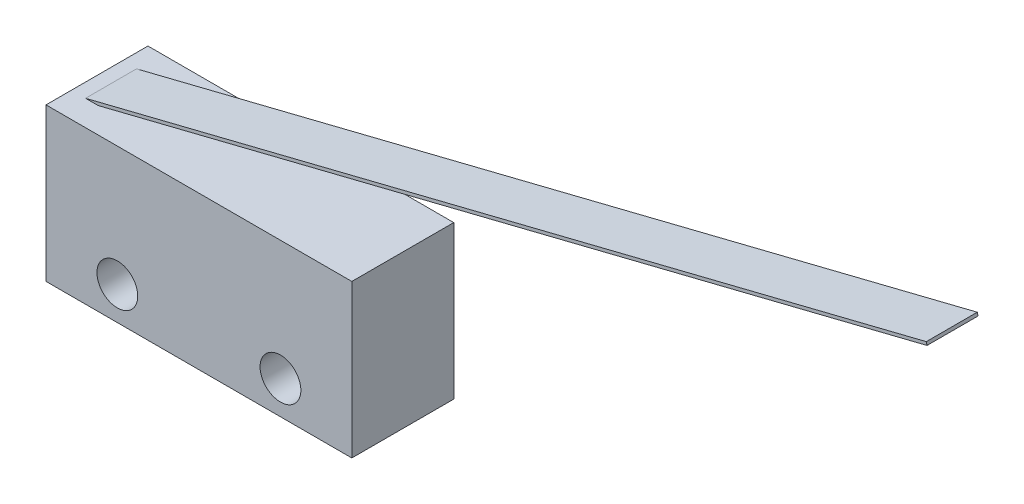
from build123d import *

# Parameters (mm, degrees)
SKETCH1_W           = 19.05
SKETCH1_H           = 9.525
BOSS_EXTRUDE1_DEPTH = 6.35
BOSS_EXTRUDE2_START = 1.5875
BOSS_EXTRUDE2_DEPTH = 3.175
SKETCH3_R           = 1.27
CUT_EXTRUDE1_DEPTH  = 59.227939899


with BuildPart() as part:
    # Sketch1 → Boss-Extrude1 (new body)
    with BuildSketch(Plane.XY):
        with Locations((9.525, 4.7625)):
            Rectangle(SKETCH1_W, SKETCH1_H)
    extrude(amount=BOSS_EXTRUDE1_DEPTH)

    # Sketch2 → Boss-Extrude2 (add)
    with BuildSketch(Plane.XY.offset(BOSS_EXTRUDE2_START)):
        Polygon((0.875640633, 9.525), (53.247352459, 22.582734315), (53.29343858, 22.397892979), (1.66308486, 9.525), align=None)
    extrude(amount=BOSS_EXTRUDE2_DEPTH)

    # Sketch3 → Cut-Extrude1 (cut, through all)
    with BuildSketch(Plane.XY.offset(6.35)):
        with Locations((4.445, 2.06375)):
            Circle(SKETCH3_R)
        with Locations(Location((14.605, 2.06375, 0), (0, 0, 180))):
            Circle(SKETCH3_R)
    extrude(amount=-CUT_EXTRUDE1_DEPTH, mode=Mode.SUBTRACT)


solid = part.part
